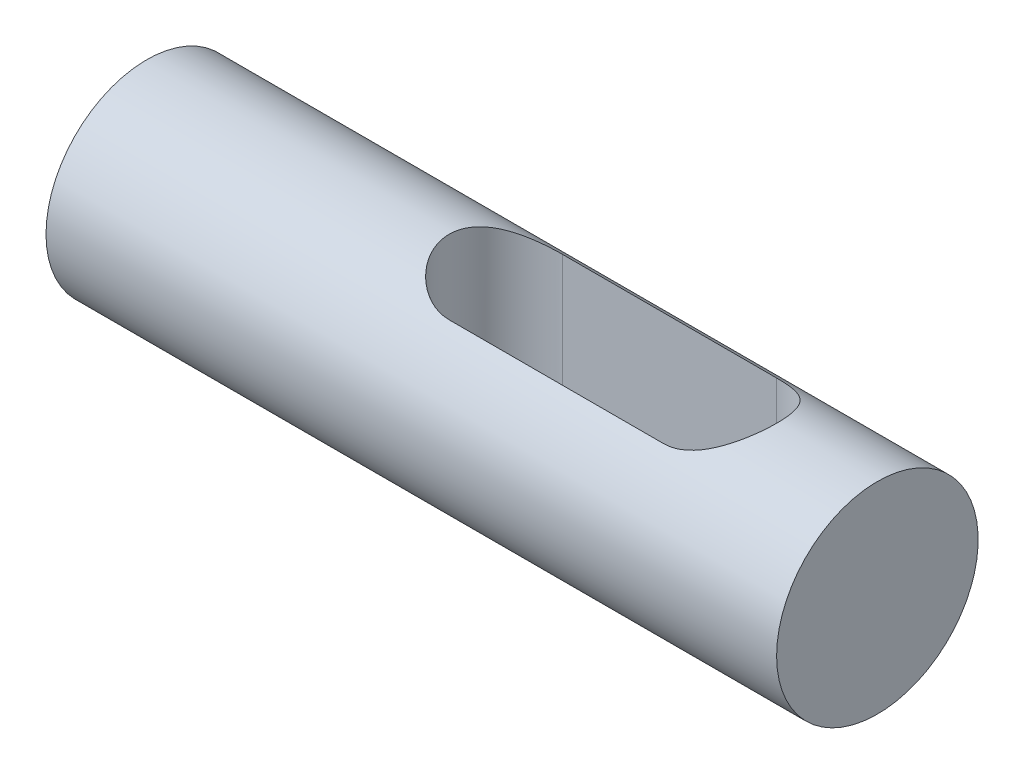
from build123d import *

# Parameters (mm, degrees)
SKETCH1_W               = 14.5
SKETCH1_H               = 2
CUT_EXTRUDE1_DEPTH      = 8.782191208
CUT_EXTRUDE1_DEPTH_BACK = 8.782191208


with BuildPart() as part:
    # Sketch1 → Revolve1 (revolve)
    with BuildSketch(Plane(origin=(0, 0, 0), x_dir=(1, 0, 0), z_dir=(0, 1, 0)), mode=Mode.PRIVATE) as revolve1_sk:
        with Locations((0, 1)):
            Rectangle(SKETCH1_W, SKETCH1_H)
    revolve(revolve1_sk.sketch.rotate(Axis((-7.25, 0, 0), (1, 0, 0)), 180), axis=Axis((-7.25, 0, 0), (1, 0, 0)))

    # Sketch2 → Cut-Extrude1 (cut, two sides: drawn at the far end of the back side and taken through both)
    with BuildSketch(Plane(origin=(0, 0, 0), x_dir=(1, 0, 0), z_dir=(0, 1, 0)).offset(-CUT_EXTRUDE1_DEPTH_BACK)):
        with BuildLine():
            Line((-0.125, 1.125), (4.125, 1.125))
            ThreePointArc((4.125, 1.125), (5.25, 0), (4.125, -1.125))
            Line((4.125, -1.125), (-0.125, -1.125))
            ThreePointArc((-0.125, -1.125), (-1.25, 0), (-0.125, 1.125))
        make_face()
    extrude(amount=CUT_EXTRUDE1_DEPTH + CUT_EXTRUDE1_DEPTH_BACK, mode=Mode.SUBTRACT)


solid = part.part
